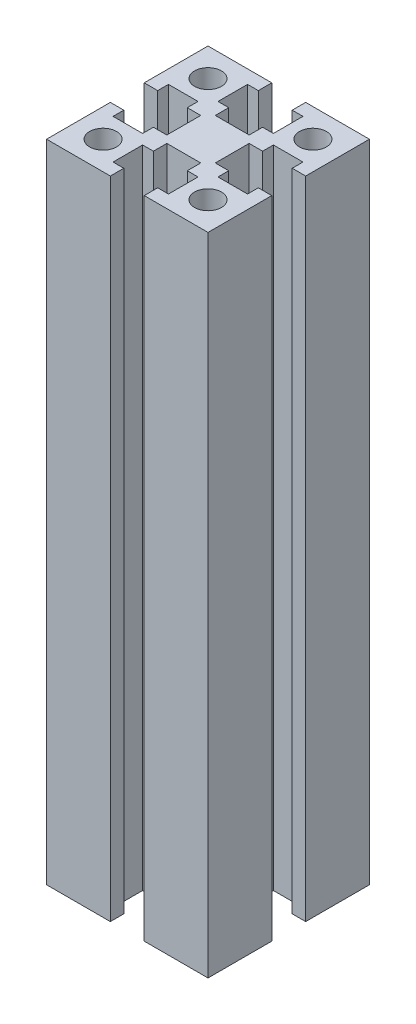
from build123d import *

# Parameters (mm, degrees)
SKETCH_1_R          = 2.5
EXTRUDE_1_DEPTH     = 180
SKETCH_2_R          = 82.250528809
CUT_EXTRUDE_1_DEPTH = 10
SKETCH_3_R          = 47.359827943
CUT_EXTRUDE_2_DEPTH = 200
SKETCH_4_R          = 50.055938799
CUT_EXTRUDE_3_DEPTH = 30


with BuildPart() as part:
    # 草图1 → 凸台-拉伸1 (new, symmetric)
    with BuildSketch(Plane(origin=(0, 0, 0), x_dir=(1, 0, 0), z_dir=(0, 1, 0))):
        Polygon((-15, -3.15), (-12.5, -3.15), (-12.5, -5.15), (-7, -5.15), (-7, -3.15), (-4.5, -3.15), (-4.5, 3.15), (-7, 3.15), (-7, 5.15), (-12.5, 5.15), (-12.5, 3.15), (-15, 3.15), (-15, 15), (-3.15, 15), (-3.15, 12.5), (-5.15, 12.5), (-5.15, 7), (-3.15, 7), (-3.15, 4.5), (3.15, 4.5), (3.15, 7), (5.15, 7), (5.15, 12.5), (3.15, 12.5), (3.15, 15), (15, 15), (15, 3.15), (12.5, 3.15), (12.5, 5.15), (7, 5.15), (7, 3.15), (4.5, 3.15), (4.5, -3.15), (7, -3.15), (7, -5.15), (12.5, -5.15), (12.5, -3.15), (15, -3.15), (15, -15), (3.15, -15), (3.15, -12.5), (5.15, -12.5), (5.15, -7), (3.15, -7), (3.15, -4.5), (-3.15, -4.5), (-3.15, -7), (-5.15, -7), (-5.15, -12.5), (-3.15, -12.5), (-3.15, -15), (-15, -15), align=None)
        with Locations(Location((-9.75, -9.75, 0), (0, 0, 90))):
            Circle(SKETCH_1_R, mode=Mode.SUBTRACT)
        with Locations(Location((-9.75, 9.75, 0), (0, 0, 90))):
            Circle(SKETCH_1_R, mode=Mode.SUBTRACT)
        with Locations(Location((9.75, 9.75, 0), (0, 0, 90))):
            Circle(SKETCH_1_R, mode=Mode.SUBTRACT)
        with Locations(Location((9.75, -9.75, 0), (0, 0, 90))):
            Circle(SKETCH_1_R, mode=Mode.SUBTRACT)
    extrude(amount=EXTRUDE_1_DEPTH, both=True)

    # 草图2 → 切除-拉伸1 (cut)
    with BuildSketch(Plane(origin=(0, 180, 0), x_dir=(1, 0, 0), z_dir=(0, 1, 0))):
        Circle(SKETCH_2_R)
    extrude(amount=-CUT_EXTRUDE_1_DEPTH, mode=Mode.SUBTRACT)

    # 草图3 → 切除-拉伸2 (cut)
    with BuildSketch(Plane.XZ.offset(180)):
        with Locations((0.216432031, -1.772037256)):
            Circle(SKETCH_3_R)
    extrude(amount=-CUT_EXTRUDE_2_DEPTH, mode=Mode.SUBTRACT)

    # 草图4 → 切除-拉伸3 (cut)
    with BuildSketch(Plane.XZ.offset(-20)):
        with Locations((-1.287426062, -1.543634952)):
            Circle(SKETCH_4_R)
    extrude(amount=-CUT_EXTRUDE_3_DEPTH, mode=Mode.SUBTRACT)


solid = part.part
